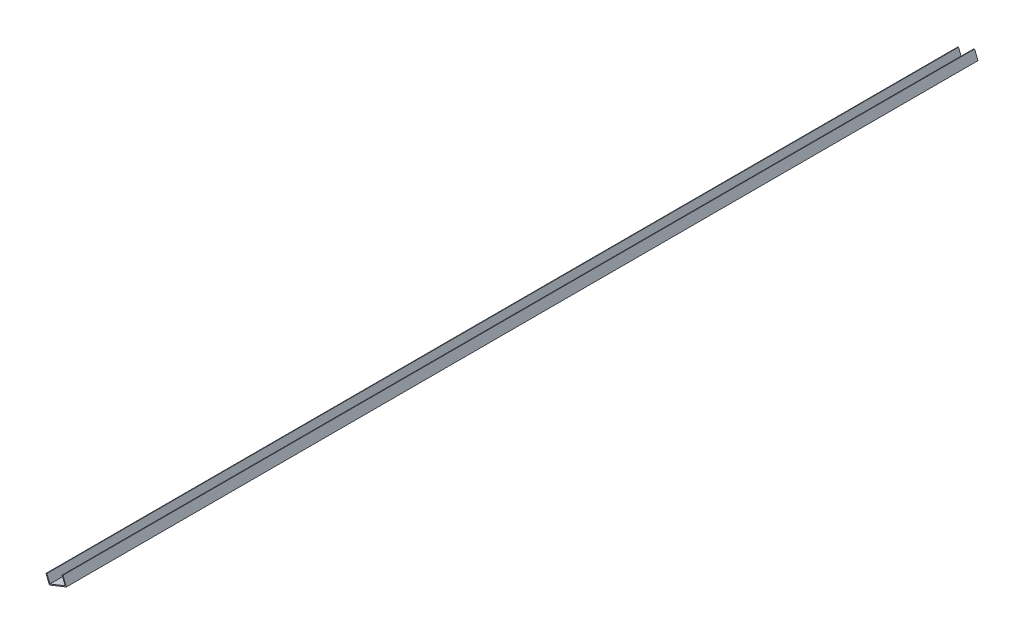
from build123d import *

# Parameters (mm, degrees)
EXTRUDE_1_DEPTH = 5000


with BuildPart() as part:
    # 草图1 → 凸台-拉伸1 (new body)
    with BuildSketch(Plane.XY):
        Polygon((6775.521017344, 10588.641560672), (6756.885396495, 10635.038905807), (6761.525131008, 10636.902467892), (6778.297189773, 10595.14485727), (6861.812411015, 10628.688974799), (6845.040352251, 10670.446585421), (6849.680086764, 10672.310147505), (6868.315707614, 10625.912802371), align=None)
    extrude(amount=EXTRUDE_1_DEPTH)


solid = part.part
